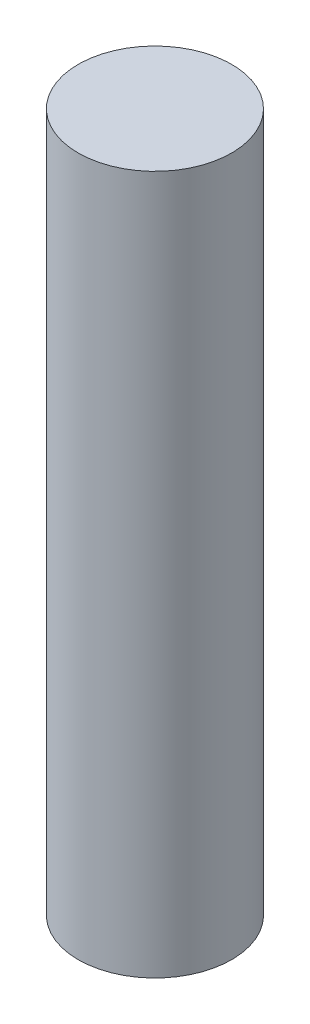
from build123d import *

# Parameters (mm, degrees)
SKETCH1_R           = 40
BOSS_EXTRUDE1_DEPTH = 364


with BuildPart() as part:
    # Sketch1 → Boss-Extrude1 (new body)
    with BuildSketch(Plane(origin=(0, 0, 0), x_dir=(1, 0, 0), z_dir=(0, 1, 0))):
        with Locations(Location((0, 0, 0), (0, 0, 270))):
            Circle(SKETCH1_R)
    extrude(amount=BOSS_EXTRUDE1_DEPTH)


solid = part.part
